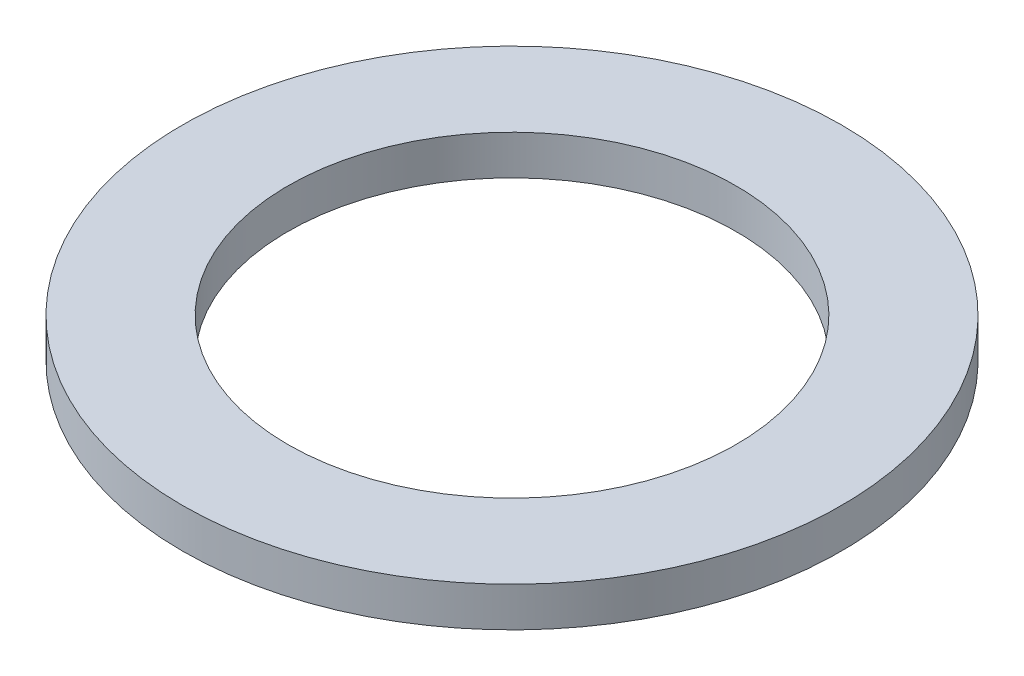
from build123d import *

# Parameters (mm, degrees)
SZKIC1_W = 8
SZKIC1_H = 3


with BuildPart() as part:
    # Szkic1 → Obrót1 (revolve)
    with BuildSketch(Plane.XY, mode=Mode.PRIVATE) as obr_t1_sk:
        with Locations((21, -1.5)):
            Rectangle(SZKIC1_W, SZKIC1_H)
    revolve(obr_t1_sk.sketch.rotate(Axis((0, 0, 0), (0, -1, 0)), 90), axis=Axis((0, 0, 0), (0, -1, 0)))


solid = part.part
